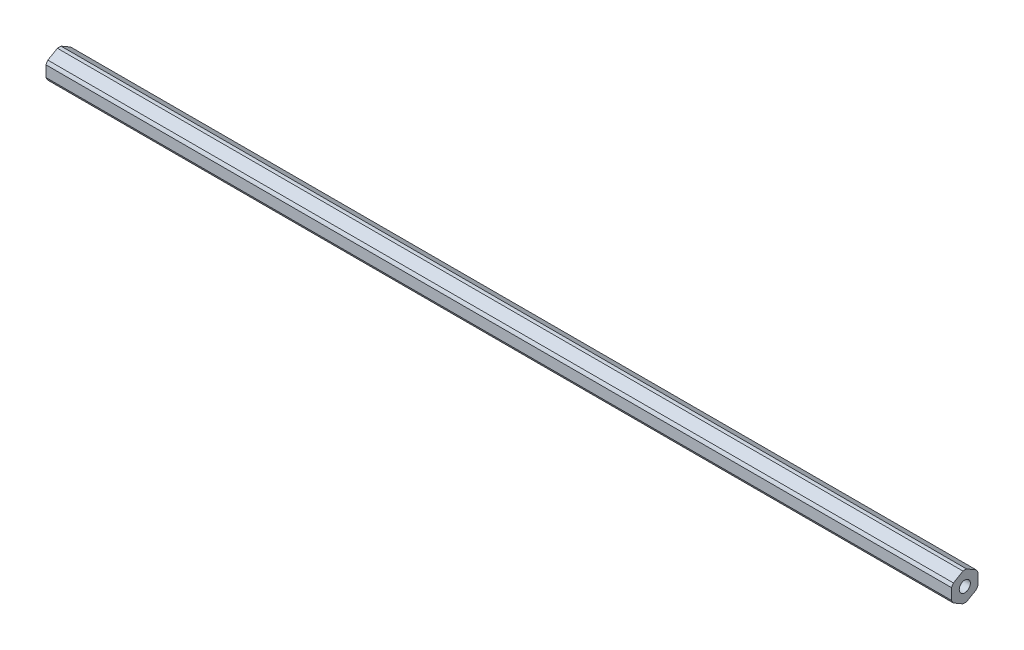
from build123d import *

# Parameters (mm, degrees)
SKETCH1_R           = 2.667
BOSS_EXTRUDE1_DEPTH = 435.102


with BuildPart() as part:
    # Sketch1 → Boss-Extrude1 (new body)
    with BuildSketch(Plane(origin=(244.475, 0, 0), x_dir=(0, 0, -1), z_dir=(1, 0, 0))):
        with BuildLine():
            Line((5.468234615, 4.175261692), (0.881765385, 6.823260936))
            ThreePointArc((0.881765385, 6.823260936), (0, 6.88), (-0.881765385, 6.823260936))
            Line((-0.881765385, 6.823260936), (-5.468234615, 4.175261692))
            ThreePointArc((-5.468234615, 4.175261692), (-5.958254778, 3.44), (-6.35, 2.647999245))
            Line((-6.35, 2.647999245), (-6.35, -2.647999245))
            ThreePointArc((-6.35, -2.647999245), (-5.958254778, -3.44), (-5.468234615, -4.175261692))
            Line((-5.468234615, -4.175261692), (-0.881765385, -6.823260936))
            ThreePointArc((-0.881765385, -6.823260936), (0, -6.88), (0.881765385, -6.823260936))
            Line((0.881765385, -6.823260936), (5.468234615, -4.175261692))
            ThreePointArc((5.468234615, -4.175261692), (5.958254778, -3.44), (6.35, -2.647999245))
            Line((6.35, -2.647999245), (6.35, 2.647999245))
            ThreePointArc((6.35, 2.647999245), (5.958254778, 3.44), (5.468234615, 4.175261692))
        make_face()
        with Locations(Location((0, 0, 0), (0, 0, 180))):
            Circle(SKETCH1_R, mode=Mode.SUBTRACT)
    extrude(amount=-BOSS_EXTRUDE1_DEPTH)


solid = part.part
